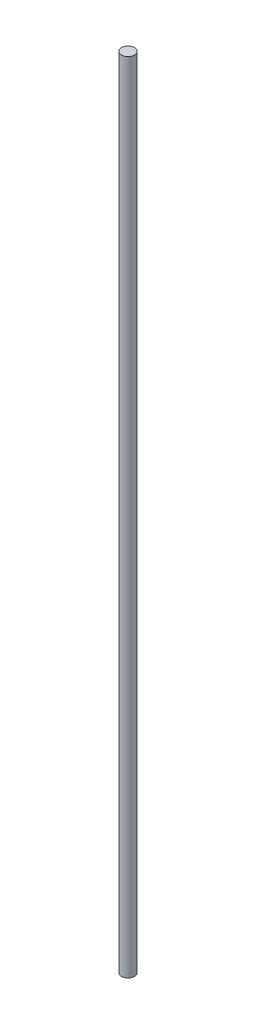
from build123d import *

# Parameters (mm, degrees)
SKETCH1_R           = 4
BOSS_EXTRUDE1_DEPTH = 490


with BuildPart() as part:
    # Sketch1 → Boss-Extrude1 (new body)
    with BuildSketch(Plane(origin=(0, 0, 0), x_dir=(1, 0, 0), z_dir=(0, 1, 0))):
        with Locations(Location((0, 0, 0), (0, 0, 270))):
            Circle(SKETCH1_R)
    extrude(amount=BOSS_EXTRUDE1_DEPTH)


solid = part.part
